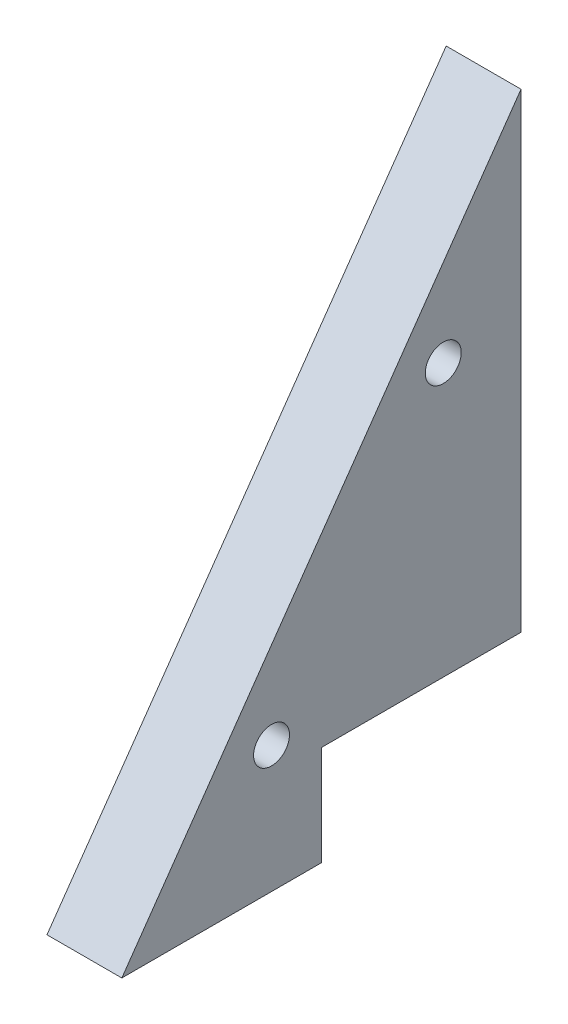
from build123d import *

# Parameters (mm, degrees)
BOSS_EXTRUDE1_DEPTH = 9.525
SKETCH2_R           = 1.905
CUT_EXTRUDE1_DEPTH  = 9.525
SKETCH3_R           = 2.286
CUT_EXTRUDE2_DEPTH  = 78.455641076


with BuildPart() as part:
    # Sketch1 → Boss-Extrude1 (new body)
    with BuildSketch(Plane(origin=(0, 0, 0), x_dir=(0, 0, -1), z_dir=(1, 0, 0))):
        Polygon((0, 0), (-25.4, 0), (25.4, 72.549918742), (25.4, 12.7), (0, 12.7), align=None)
    extrude(amount=BOSS_EXTRUDE1_DEPTH)

    # Sketch2 → Cut-Extrude1 (cut)
    with BuildSketch(Plane.XZ.offset(-12.7)):
        with Locations(Location((4.7625, -19.05, 0), (0, 0, 270))):
            Circle(SKETCH2_R)
        with Locations(Location((4.7625, -6.35, 0), (0, 0, 270))):
            Circle(SKETCH2_R)
    extrude(amount=-CUT_EXTRUDE1_DEPTH, mode=Mode.SUBTRACT)

    # Sketch3 → Cut-Extrude2 (cut, through all)
    with BuildSketch(Plane(origin=(9.525, 0, 0), x_dir=(0, 0, -1), z_dir=(1, 0, 0))):
        with Locations((-6.35, 16.135332376)):
            Circle(SKETCH3_R)
        with Locations((15.503262225, 47.345025264)):
            Circle(SKETCH3_R)
    extrude(amount=-CUT_EXTRUDE2_DEPTH, mode=Mode.SUBTRACT)


solid = part.part
